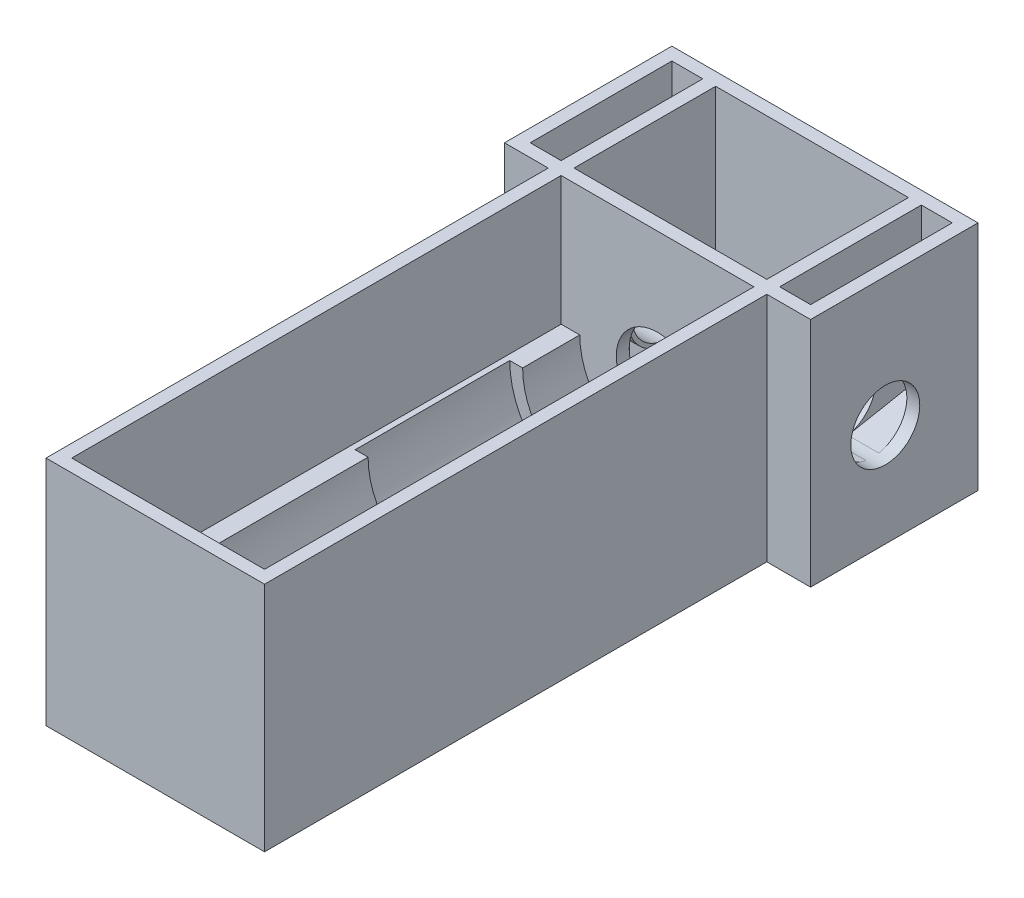
from build123d import *

# Parameters (mm, degrees)
BOSS_EXTRUDE1_START      = 15.24
BOSS_EXTRUDE1_DEPTH      = 38.1
SKETCH2_W                = 53.879496
SKETCH2_H                = 57.15
BOSS_EXTRUDE2_DEPTH      = 3.175
CUT_EXTRUDE2_DEPTH       = 68.189672735
CUT_EXTRUDE2_DEPTH_BACK  = 68.189672735
SKETCH3_R                = 8.5
SKETCH7_W                = 7.62
SKETCH7_H                = 9.935154996
BOSS_EXTRUDE7_DEPTH      = 1.5875
SKETCH8_W                = 53.879496
SKETCH8_H                = 57.15
BOSS_EXTRUDE8_DEPTH      = 127
CUT_EXTRUDE7_DEPTH       = 156.640901187
CUT_EXTRUDE7_DEPTH_BACK  = 156.640901187
SKETCH13_W               = 0.002356984
SKETCH13_H               = 126.769061331
CUT_EXTRUDE8_START       = -31.75
SKETCH14_W               = 47.527139016
SKETCH14_H               = 120.65
CUT_EXTRUDE8_DEPTH       = 31.75
CUT_EXTRUDE9_DEPTH       = 1.689066359
SKETCH18_W               = 13.97
SKETCH18_H               = 41.275
SKETCH18_W_2             = 7.62
SKETCH18_H_2             = 34.925
BOSS_EXTRUDE10_DEPTH     = 57.15
BOSS_EXTRUDE11_REACH     = 164.485
CUT_EXTRUDE11_DEPTH      = 166.168181283
CUT_EXTRUDE11_DEPTH_BACK = 166.168181283
SKETCH20_R               = 8.5


with BuildPart() as part:
    # Sketch1 → Boss-Extrude1 (new body)
    with BuildSketch(Plane.XY.offset(BOSS_EXTRUDE1_START)):
        Polygon((-26.939748, 0), (26.939748, 0), (26.939748, 6.35), (26.939748, 57.15), (23.764748, 57.15), (23.764748, 6.35), (-23.764748, 6.35), (-23.764748, 57.15), (-26.939748, 57.15), (-26.939748, 6.35), align=None)
    extrude(amount=-BOSS_EXTRUDE1_DEPTH)

    # Sketch2 → Boss-Extrude2 (add)
    with BuildSketch(Plane.XY.offset(-22.86)):
        with Locations((0, 28.575)):
            Rectangle(SKETCH2_W, SKETCH2_H)
    extrude(amount=BOSS_EXTRUDE2_DEPTH)

    # Sketch6 → Revolve2 (revolve)
    with BuildSketch(Plane.XY, mode=Mode.PRIVATE) as revolve2_sk:
        Polygon((-23.764748, 25.4), (-16.144748, 25.4), (-16.144748, 34.90000005), (-21.224748, 34.90000005), (-23.764748, 36.068), align=None)
        Polygon((23.764748, 36.068), (23.764748, 25.4), (16.144748, 25.4), (16.144748, 34.90000005), (21.224748, 34.90000005), align=None)
    revolve(revolve2_sk.sketch.rotate(Axis((-23.764748, 25.4, 0), (1, 0, 0)), 90), axis=Axis((-23.764748, 25.4, 0), (1, 0, 0)))

    # Sketch3 → Cut-Extrude2 (cut, two sides: drawn at the far end of the back side and taken through both)
    with BuildSketch(Plane(origin=(0, 0, 0), x_dir=(0, 0, -1), z_dir=(1, 0, 0)).offset(-CUT_EXTRUDE2_DEPTH_BACK)):
        with Locations((0, 25.4)):
            Circle(SKETCH3_R)
    extrude(amount=CUT_EXTRUDE2_DEPTH + CUT_EXTRUDE2_DEPTH_BACK, mode=Mode.SUBTRACT)

    # Sketch7 → Boss-Extrude7 (add, symmetric)
    with BuildSketch(Plane.XY):
        with Locations((-19.954748, 11.317577498)):
            Rectangle(SKETCH7_W, SKETCH7_H)
        with Locations((19.954748, 11.317577498)):
            Rectangle(SKETCH7_W, SKETCH7_H)
    extrude(amount=BOSS_EXTRUDE7_DEPTH, both=True)

    # Sketch8 → Boss-Extrude8 (add)
    with BuildSketch(Plane(origin=(0, 0, 15.24), x_dir=(-1, 0, 0), z_dir=(0, 0, -1))):
        with Locations((0, 28.575)):
            Rectangle(SKETCH8_W, SKETCH8_H)
    extrude(amount=-BOSS_EXTRUDE8_DEPTH)

    # Sketch9 → Cut-Revolve1 (revolve, cut)
    with BuildSketch(Plane(origin=(0, 0, 0), x_dir=(0, 0, -1), z_dir=(1, 0, 0))):
        Polygon((-70.6, 47.752), (-70.6, 44.577), (-139.065, 44.577), (-139.065, 25.4), (-70.104, 25.4), (0, 25.4), (0, 35.56), (-20.104066359, 35.56), (-20.104066359, 44.577), (-32.5, 44.577), (-32.5, 47.752), align=None)
    revolve(axis=Axis((0, 25.4, 0), (0, 0, 1)), mode=Mode.SUBTRACT)

    # Sketch13 → Cut-Extrude7 (cut, two sides: drawn at the far end of the back side and taken through both)
    with BuildSketch(Plane(origin=(0, 0, 0), x_dir=(-1, 0, 0), z_dir=(0, -1, 0)).offset(-CUT_EXTRUDE7_DEPTH_BACK)):
        with Locations((26.940926492, -78.855469335)):
            Rectangle(SKETCH13_W, SKETCH13_H)
        with Locations((-26.938569508, -78.855469335)):
            Rectangle(SKETCH13_W, SKETCH13_H)
    extrude(amount=CUT_EXTRUDE7_DEPTH + CUT_EXTRUDE7_DEPTH_BACK, mode=Mode.SUBTRACT)

    # Sketch14 → Cut-Extrude8 (cut)
    with BuildSketch(Plane(origin=(0, 57.15, 0), x_dir=(1, 0, 0), z_dir=(0, 1, 0)).offset(CUT_EXTRUDE8_START)):
        with Locations((-0.001178492, -78.74)):
            Rectangle(SKETCH14_W, SKETCH14_H)
    extrude(amount=CUT_EXTRUDE8_DEPTH, mode=Mode.SUBTRACT)

    # Sketch15 → Cut-Extrude9 (cut)
    with BuildSketch(Plane.XY.offset(20.104066359)):
        with BuildLine():
            Line((-10.16, 25.4), (-19.177, 25.4))
            ThreePointArc((-19.177, 25.4), (0, 6.223), (19.177, 25.4))
            Line((19.177, 25.4), (10.16, 25.4))
            ThreePointArc((10.16, 25.4), (0, 15.24), (-10.16, 25.4))
        make_face()
    extrude(amount=-CUT_EXTRUDE9_DEPTH, mode=Mode.SUBTRACT)

    # Sketch18 → Boss-Extrude10 (add)
    with BuildSketch(Plane(origin=(0, 0, 0), x_dir=(1, 0, 0), z_dir=(0, 1, 0))):
        with Locations((-30.749748, 2.2225)):
            Rectangle(SKETCH18_W, SKETCH18_H)
        with Locations((-30.749748, 2.2225)):
            Rectangle(SKETCH18_W_2, SKETCH18_H_2, mode=Mode.SUBTRACT)
    boss_extrude10 = extrude(amount=BOSS_EXTRUDE10_DEPTH)

    # Sketch19 → Boss-Extrude11 (add, up to next)
    with BuildSketch(Plane(origin=(-26.939748, 0, 0), x_dir=(0, 0, -1), z_dir=(1, 0, 0)), mode=Mode.PRIVATE) as boss_extrude11_sk1:
        with BuildLine():
            Line((1.5875, 17.049560266), (22.225, 20.972950206))
            Line((22.225, 20.972950206), (22.225, 0))
            Line((22.225, 0), (-15.24, 0))
            Line((-15.24, 0), (-15.24, 19.645033611))
            Line((-15.24, 19.645033611), (-1.5875, 17.049560266))
            ThreePointArc((-1.5875, 17.049560266), (0, 16.9), (1.5875, 17.049560266))
        make_face()
    boss_extrude11_tool1 = extrude(boss_extrude11_sk1.sketch, amount=-BOSS_EXTRUDE11_REACH, mode=Mode.PRIVATE) - part.part
    boss_extrude11 = boss_extrude11_tool1.solids().sort_by_distance((-26.939748, 9.331139, -3.822254))[0]
    add(boss_extrude11)

    # Mirror4: Boss-Extrude10, Boss-Extrude11 across plane
    add(boss_extrude10.mirror(Plane(origin=(0, 0, 0), x_dir=(0, 0, 1), z_dir=(1, 0, 0))))
    add(boss_extrude11.mirror(Plane(origin=(0, 0, 0), x_dir=(0, 0, 1), z_dir=(1, 0, 0))))

    # Sketch20 → Cut-Extrude11 (cut, two sides: drawn at the far end of the back side and taken through both)
    with BuildSketch(Plane(origin=(-23.764748, 0, 0), x_dir=(0, 0, -1), z_dir=(1, 0, 0)).offset(-CUT_EXTRUDE11_DEPTH_BACK)):
        with Locations((0, 25.4)):
            Circle(SKETCH20_R)
    extrude(amount=CUT_EXTRUDE11_DEPTH + CUT_EXTRUDE11_DEPTH_BACK, mode=Mode.SUBTRACT)


solid = part.part
